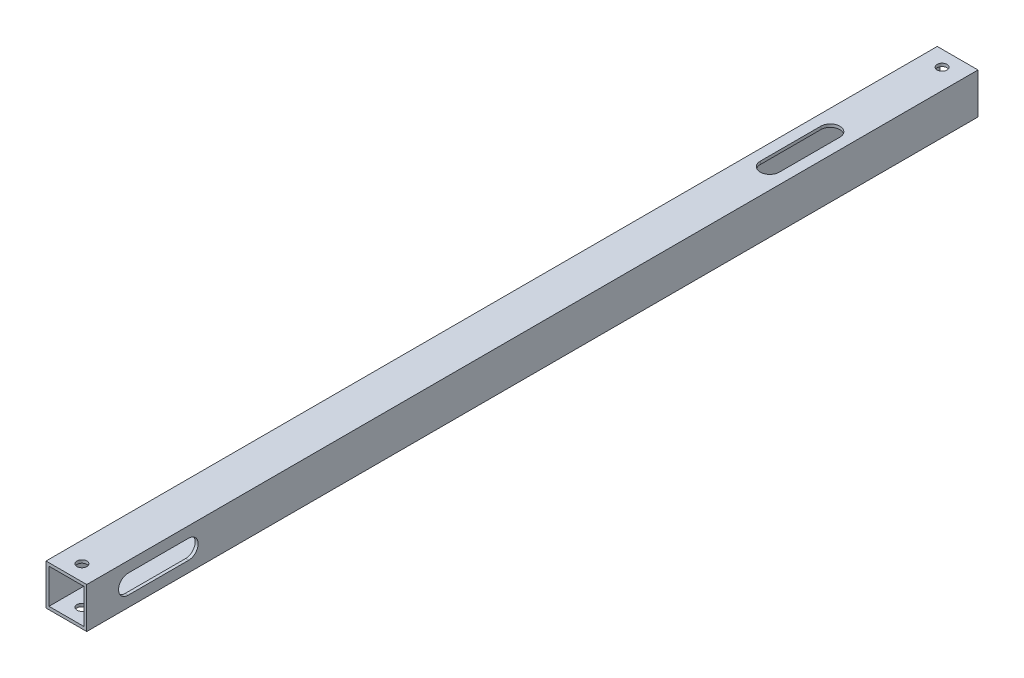
from build123d import *

# Parameters (mm, degrees)
CROQUIS1_W                 = 12.8
CROQUIS1_H                 = 12.8
CROQUIS1_W_2               = 10.92
CROQUIS1_H_2               = 10.92
EXTRUIR_L_MINA1_DEPTH      = 280
CORTAR_EXTRUIR1_DEPTH      = 10
CORTAR_EXTRUIR1_DEPTH_BACK = 10
CROQUIS2_R                 = 1.55
CORTAR_EXTRUIR2_DEPTH      = 10
CORTAR_EXTRUIR5_DEPTH      = 10


with BuildPart() as part:
    # Croquis1 → Extruir-Lámina1 (new body)
    with BuildSketch(Plane.XY):
        Rectangle(CROQUIS1_W, CROQUIS1_H)
        Rectangle(CROQUIS1_W_2, CROQUIS1_H_2, mode=Mode.SUBTRACT)
    extrude(amount=-EXTRUIR_L_MINA1_DEPTH)

    # Croquis2 → Cortar-Extruir1 (cut, two sides: drawn at the far end of the back side and taken through both)
    with BuildSketch(Plane(origin=(0, 0, 0), x_dir=(1, 0, 0), z_dir=(0, 1, 0)).offset(-CORTAR_EXTRUIR1_DEPTH_BACK)):
        with Locations((0, 4.89)):
            Circle(CROQUIS2_R)
        with Locations((0, 275.11)):
            Circle(CROQUIS2_R)
    extrude(amount=CORTAR_EXTRUIR1_DEPTH + CORTAR_EXTRUIR1_DEPTH_BACK, mode=Mode.SUBTRACT)

    # Croquis2<3> → Cortar-Extruir2 (cut)
    with BuildSketch(Plane(origin=(0, 0, 0), x_dir=(1, 0, 0), z_dir=(0, 1, 0))):
        with BuildLine():
            Line((3, 240), (3, 221))
            ThreePointArc((3, 221), (0, 218), (-3, 221))
            Line((-3, 221), (-3, 240))
            ThreePointArc((-3, 240), (0, 243), (3, 240))
        make_face()
    extrude(amount=CORTAR_EXTRUIR2_DEPTH, mode=Mode.SUBTRACT)

    # Croquis3 → Cortar-Extruir5 (cut)
    with BuildSketch(Plane(origin=(6.4, 0, 0), x_dir=(0, 0, -1), z_dir=(1, 0, 0))):
        with BuildLine():
            Line((13, 3), (32, 3))
            ThreePointArc((32, 3), (35, 0), (32, -3))
            Line((32, -3), (13, -3))
            ThreePointArc((13, -3), (10, 0), (13, 3))
        make_face()
    extrude(amount=-CORTAR_EXTRUIR5_DEPTH, mode=Mode.SUBTRACT)


solid = part.part
